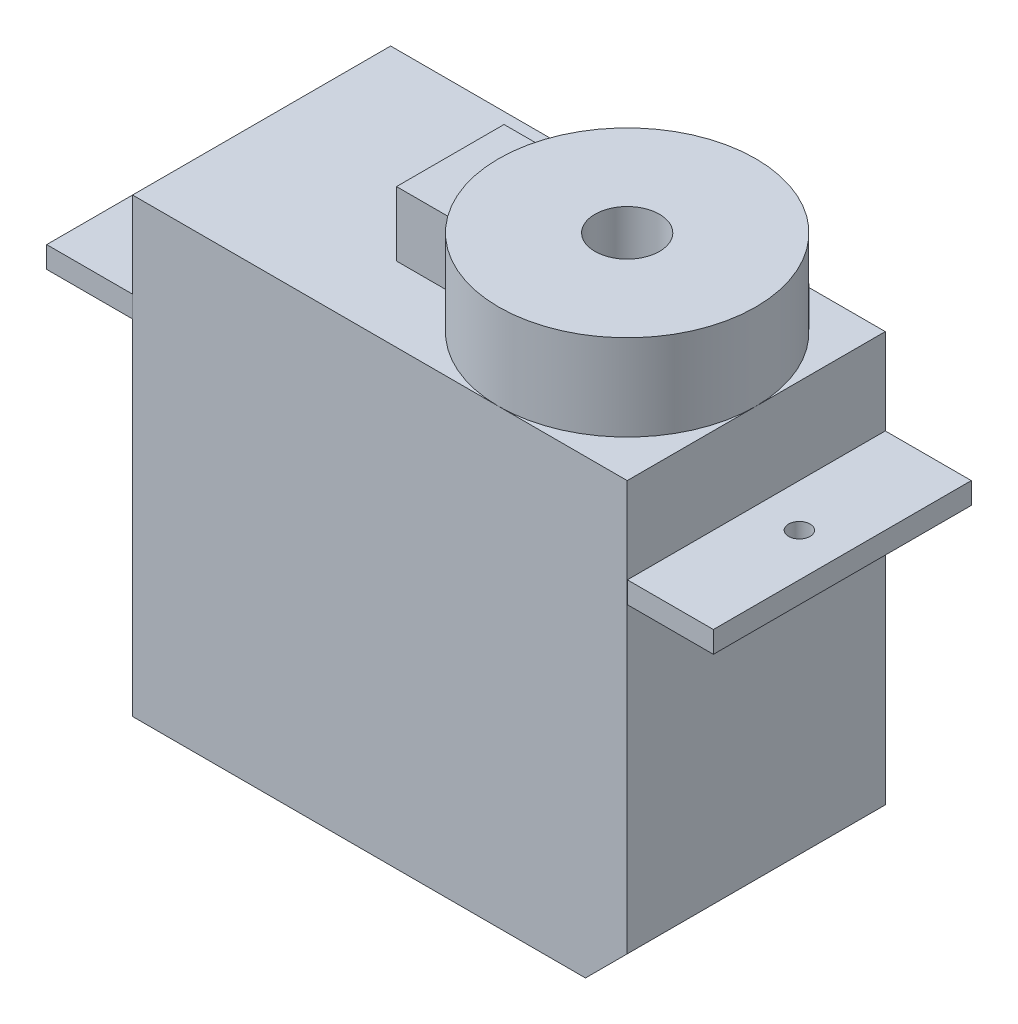
from build123d import *

# Parameters (mm, degrees)
ESQUISSE1_W             = 23
ESQUISSE1_H             = 12
BOSS_EXTRU_1_DEPTH      = 21
ESQUISSE2_W             = 4
ESQUISSE2_H             = 11.992585314
BOSS_EXTRU_2_DEPTH      = 1
ESQUISSE3_R             = 0.5
ENL_V_MAT_EXTRU_1_DEPTH = 1
ESQUISSE4_R             = 5.976429807
BOSS_EXTRU_3_DEPTH      = 4
ESQUISSE5_W             = 4.5
ESQUISSE5_H             = 5
BOSS_EXTRU_4_DEPTH      = 3
ENL_V_MAT_EXTRU_3_DEPTH = 32.768695283
ESQUISSE7_R             = 1.5
ENL_V_MAT_EXTRU_4_DEPTH = 3


with BuildPart() as part:
    # Esquisse1 → Boss.-Extru.1 (new body)
    with BuildSketch(Plane(origin=(0, 0, 0), x_dir=(1, 0, 0), z_dir=(0, 1, 0))):
        Rectangle(ESQUISSE1_W, ESQUISSE1_H)
    extrude(amount=BOSS_EXTRU_1_DEPTH)

    # Esquisse2 → Boss.-Extru.2 (add)
    with BuildSketch(Plane(origin=(0, 16, 0), x_dir=(1, 0, 0), z_dir=(0, 1, 0))):
        with Locations((13.5, 0.003707343)):
            Rectangle(ESQUISSE2_W, ESQUISSE2_H)
    boss_extru_2 = extrude(amount=BOSS_EXTRU_2_DEPTH)

    # Esquisse3 → Enlèv. mat.-Extru.1 (cut)
    with BuildSketch(Plane(origin=(0, 17, 0), x_dir=(1, 0, 0), z_dir=(0, 1, 0))):
        with Locations(Location((13.5, 0.003707343, 0), (0, 0, 270))):
            Circle(ESQUISSE3_R)
    enl_v_mat_extru_1 = extrude(amount=-ENL_V_MAT_EXTRU_1_DEPTH, mode=Mode.SUBTRACT)

    # Symétrie1: Boss.-Extru.2 across plane
    add(boss_extru_2.mirror(Plane(origin=(0, 0, 0), x_dir=(0, 0, 1), z_dir=(1, 0, 0))))

    # Symétrie2: Enlèv. mat.-Extru.1 across plane
    add(enl_v_mat_extru_1.mirror(Plane(origin=(0, 0, 0), x_dir=(0, 0, 1), z_dir=(1, 0, 0))), mode=Mode.SUBTRACT)

    # Esquisse4 → Boss.-Extru.3 (add)
    with BuildSketch(Plane(origin=(0, 21, 0), x_dir=(1, 0, 0), z_dir=(0, 1, 0))):
        with Locations(Location((5.523570193, -0.023570193, 0), (0, 0, 270))):
            Circle(ESQUISSE4_R)
    extrude(amount=BOSS_EXTRU_3_DEPTH)

    # Esquisse5 → Boss.-Extru.4 (add)
    with BuildSketch(Plane(origin=(0, 21, 0), x_dir=(1, 0, 0), z_dir=(0, 1, 0))):
        with Locations((-0.452859613, -0.023570193)):
            Rectangle(ESQUISSE5_W, ESQUISSE5_H)
    extrude(amount=BOSS_EXTRU_4_DEPTH)

    # Esquisse6 → Enlèv. mat.-Extru.3 (cut, through all)
    with BuildSketch(Plane.XY.offset(6)):
        Polygon((9.55941942, 0), (11.5, 1.94058058), (11.5, 0), align=None)
    extrude(amount=-ENL_V_MAT_EXTRU_3_DEPTH, mode=Mode.SUBTRACT)

    # Esquisse7 → Enlèv. mat.-Extru.4 (cut)
    with BuildSketch(Plane(origin=(0, 25, 0), x_dir=(1, 0, 0), z_dir=(0, 1, 0))):
        with Locations(Location((5.523570193, -0.023570193, 0), (0, 0, 270))):
            Circle(ESQUISSE7_R)
    extrude(amount=-ENL_V_MAT_EXTRU_4_DEPTH, mode=Mode.SUBTRACT)


solid = part.part
